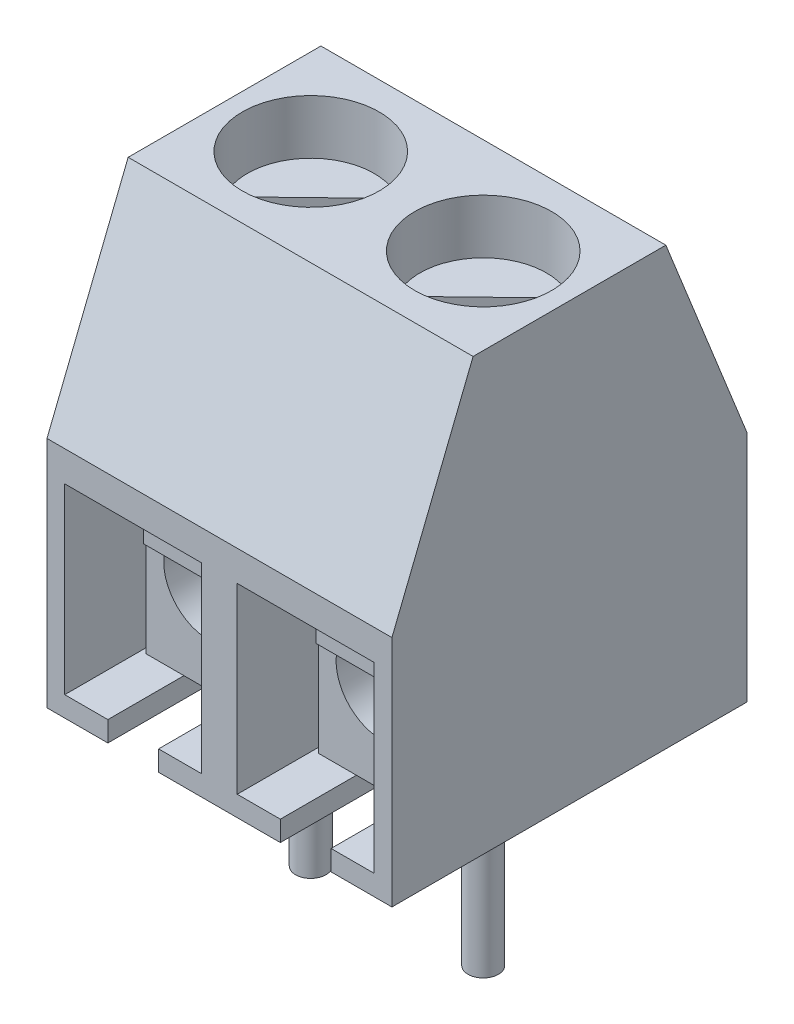
from build123d import *

# Parameters (mm, degrees)
BOSS_EXTRU_1_DEPTH         = 3.4
ENL_V_MAT_EXTRU_1_DEPTH    = 6
ENL_V_MAT_EXTRU_2_REACH    = 13.598
ESQUISSE3_R                = 1.35
BOSS_EXTRU_2_START         = -1
ESQUISSE4_R                = 1.25
BOSS_EXTRU_2_DEPTH         = 3.4
ENL_V_MAT_EXTRU_3_DEPTH    = 0.4
BOSS_EXTRU_3_START         = -1.5
ESQUISSE6_R                = 0.9
BOSS_EXTRU_3_DEPTH         = 4.5
ESQUISSE7_R                = 0.3
BOSS_EXTRU_4_DEPTH         = 4
EXTRU_MINCE1_DEPTH         = 0.7
R_P_TITION_LIN_AIRE2_COUNT = 2
R_P_TITION_LIN_AIRE2_PITCH = 3.4
R_P_TITION_LIN_AIRE3_COUNT = 2
R_P_TITION_LIN_AIRE3_PITCH = 3.4


with BuildPart() as part:
    # Esquisse1 → Boss.-Extru.1 (new body)
    with BuildSketch(Plane(origin=(0, 0, 0), x_dir=(0, 0, -1), z_dir=(1, 0, 0))):
        Polygon((0, 0), (0, 4.6), (1.6, 8.6), (5.4, 8.6), (7, 4.6), (7, 0), align=None)
    boss_extru_1 = extrude(amount=BOSS_EXTRU_1_DEPTH)

    # Esquisse2 → Enlèv. mat.-Extru.1 (cut)
    with BuildSketch(Plane.XY):
        Polygon((0.35, 0.4), (1.2, 0.4), (1.2, 0), (2.2, 0), (2.2, 0.4), (3.05, 0.4), (3.05, 4), (0.35, 4), align=None)
    enl_v_mat_extru_1 = extrude(amount=-ENL_V_MAT_EXTRU_1_DEPTH, mode=Mode.SUBTRACT)

    # Esquisse3 → Enlèv. mat.-Extru.2 (cut, up to next)
    with BuildSketch(Plane(origin=(0, 8.6, 0), x_dir=(1, 0, 0), z_dir=(0, 1, 0)), mode=Mode.PRIVATE) as enl_v_mat_extru_2_sk1:
        with Locations(Location((1.7, 3.5, 0), (0, 0, 270))):
            Circle(ESQUISSE3_R)
    enl_v_mat_extru_2_tool1 = extrude(enl_v_mat_extru_2_sk1.sketch, amount=-ENL_V_MAT_EXTRU_2_REACH, mode=Mode.PRIVATE) & part.part
    enl_v_mat_extru_2 = enl_v_mat_extru_2_tool1.solids().sort_by_distance((1.7, 8.6, -3.5))[0]
    add(enl_v_mat_extru_2, mode=Mode.SUBTRACT)

    # Répétition linéaire2: Boss.-Extru.1, Enlèv. mat.-Extru.1, Enlèv. mat.-Extru.2 ×2
    with Locations(*[(i * R_P_TITION_LIN_AIRE2_PITCH, 0, 0) for i in range(1, R_P_TITION_LIN_AIRE2_COUNT)]):
        add(boss_extru_1)
        add(enl_v_mat_extru_1, mode=Mode.SUBTRACT)
        add(enl_v_mat_extru_2, mode=Mode.SUBTRACT)


with BuildPart() as body_2:
    # Esquisse4 → Boss.-Extru.2 (new body)
    with BuildSketch(Plane(origin=(0, 8.6, 0), x_dir=(1, 0, 0), z_dir=(0, 1, 0)).offset(BOSS_EXTRU_2_START)):
        with Locations(Location((1.7, 3.5, 0), (0, 0, 270))):
            Circle(ESQUISSE4_R)
    extrude(amount=-BOSS_EXTRU_2_DEPTH)

    # Esquisse5 → Enlèv. mat.-Extru.3 (cut)
    with BuildSketch(Plane(origin=(0, 7.6, 0), x_dir=(1, 0, 0), z_dir=(0, 1, 0))):
        with BuildLine():
            Line((0.61870802, 2.87285755), (2.364496958, 4.558746331))
            ThreePointArc((2.364496958, 4.558746331), (2.59917475, 4.368322963), (2.78129198, 4.12714245))
            Line((2.78129198, 4.12714245), (1.035503042, 2.441253669))
            ThreePointArc((1.035503042, 2.441253669), (0.80082525, 2.631677037), (0.61870802, 2.87285755))
        make_face()
    extrude(amount=-ENL_V_MAT_EXTRU_3_DEPTH, mode=Mode.SUBTRACT)


with BuildPart() as body_3:
    # Esquisse6 → Boss.-Extru.3 (new body)
    with BuildSketch(Plane.XY.offset(BOSS_EXTRU_3_START)):
        Polygon((0.45, 0.4), (2.95, 0.4), (2.95, 3.9), (2.45, 3.9), (2.45, 3.65), (0.95, 3.65), (0.95, 3.9), (0.45, 3.9), align=None)
        with Locations((1.7, 2.15)):
            Circle(ESQUISSE6_R, mode=Mode.SUBTRACT)
    extrude(amount=-BOSS_EXTRU_3_DEPTH)

    # Esquisse7 → Boss.-Extru.4 (add)
    with BuildSketch(Plane.XZ.offset(-0.4)):
        with Locations((1.7, -3.5)):
            Circle(ESQUISSE7_R)
    extrude(amount=BOSS_EXTRU_4_DEPTH)


with BuildPart() as body_4:
    # Esquisse8 → Extru.-Mince1 (new, symmetric)
    with BuildSketch(Plane(origin=(1.7, 0, 0), x_dir=(0, 0, -1), z_dir=(1, 0, 0))):
        with BuildLine():
            Line((2.15, 3.9), (1.5, 3.9))
            ThreePointArc((1.5, 3.9), (1.075735931, 3.724264069), (0.9, 3.3))
            Line((0.9, 3.3), (0.9, 2.853369234))
            Line((0.9, 2.853369234), (2.391205681, 1.602099097))
            Line((2.391205681, 1.602099097), (2.519763203, 1.755307986))
            Line((2.519763203, 1.755307986), (1.1, 2.946630766))
            Line((1.1, 2.946630766), (1.1, 3.3))
            ThreePointArc((1.1, 3.3), (1.217157288, 3.582842712), (1.5, 3.7))
            Line((1.5, 3.7), (2.15, 3.7))
            Line((2.15, 3.7), (2.15, 3.9))
        make_face()
    extrude(amount=EXTRU_MINCE1_DEPTH, both=True)


with BuildPart() as r_p_tition_lin_aire3_1:
    # Répétition linéaire3: pattern copy
    add(body_2.part.moved(Location(Vector(1, 0, 0) * (1 * R_P_TITION_LIN_AIRE3_PITCH))))


with BuildPart() as r_p_tition_lin_aire3_2:
    # Répétition linéaire3: pattern copy
    add(body_4.part.moved(Location(Vector(1, 0, 0) * (1 * R_P_TITION_LIN_AIRE3_PITCH))))


with BuildPart() as r_p_tition_lin_aire3_3:
    # Répétition linéaire3: pattern copy
    add(body_3.part.moved(Location(Vector(1, 0, 0) * (1 * R_P_TITION_LIN_AIRE3_PITCH))))


solid = Compound([part.part, body_2.part, body_3.part, body_4.part, r_p_tition_lin_aire3_1.part, r_p_tition_lin_aire3_2.part, r_p_tition_lin_aire3_3.part])
